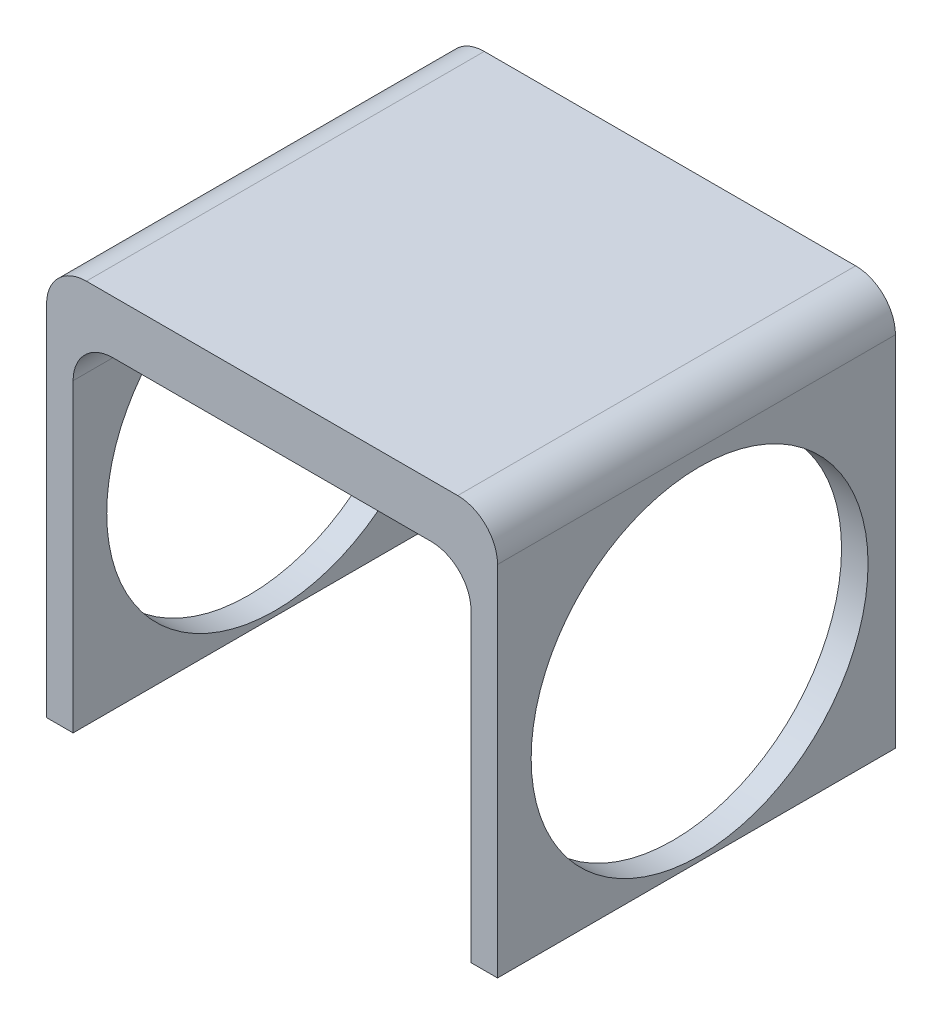
from build123d import *

# Parameters (mm, degrees)
BOSS_EXTRU_1_DEPTH = 30
PER_AGE1_D         = 25.4


with BuildPart() as part:
    # Esquisse1 → Boss.-Extru.1 (new body)
    with BuildSketch(Plane.XY):
        with BuildLine():
            Line((0, 0), (0, 27))
            ThreePointArc((0, 27), (0.878679656, 29.121320344), (3, 30))
            Line((3, 30), (31, 30))
            ThreePointArc((31, 30), (33.121320344, 29.121320344), (34, 27))
            Line((34, 27), (34, 0))
            Line((34, 0), (32, 0))
            Line((32, 0), (32, 23))
            ThreePointArc((32, 23), (31.121320344, 25.121320344), (29, 26))
            Line((29, 26), (5, 26))
            ThreePointArc((5, 26), (2.878679656, 25.121320344), (2, 23))
            Line((2, 23), (2, 0))
            Line((2, 0), (0, 0))
        make_face()
    extrude(amount=BOSS_EXTRU_1_DEPTH)

    # Perçage1 (through all)
    with Locations(Plane.ZY):
        with Locations((14.764081533, 13.067128835)):
            Hole(PER_AGE1_D / 2)


solid = part.part
